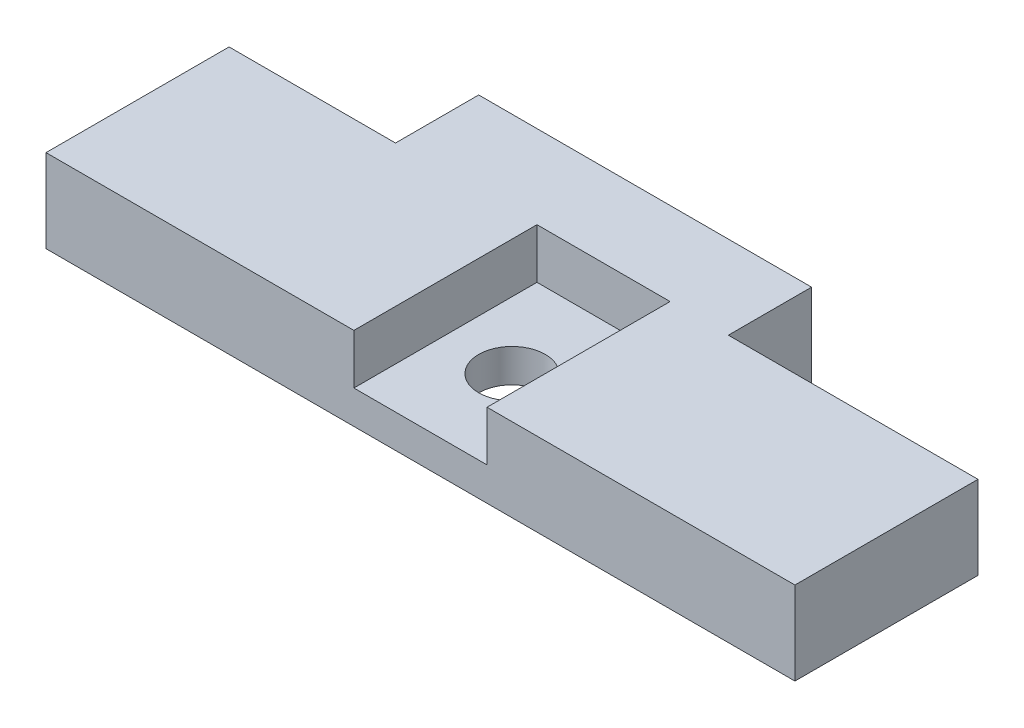
from build123d import *

# Parameters (mm, degrees)
BOSS_EXTRU_1_DEPTH      = 5
ESQUISSE2_W             = 8
ESQUISSE2_H             = 11
ENL_V_MAT_EXTRU_1_DEPTH = 3
ESQUISSE3_R             = 2
ENL_V_MAT_EXTRU_3_DEPTH = 25.067613093


with BuildPart() as part:
    # Esquisse1 → Boss.-Extru.1 (new body)
    with BuildSketch(Plane(origin=(0, 0, 0), x_dir=(1, 0, 0), z_dir=(0, 1, 0))):
        Polygon((7.5, 8), (7.5, 3), (22.5, 3), (22.5, -8), (-22.5, -8), (-22.5, 3), (-12.5, 3), (-12.5, 8), align=None)
    extrude(amount=BOSS_EXTRU_1_DEPTH)

    # Esquisse2 → Enlèv. mat.-Extru.1 (cut)
    with BuildSketch(Plane(origin=(0, 5, 0), x_dir=(1, 0, 0), z_dir=(0, 1, 0))):
        with Locations((0, -2.5)):
            Rectangle(ESQUISSE2_W, ESQUISSE2_H)
    extrude(amount=-ENL_V_MAT_EXTRU_1_DEPTH, mode=Mode.SUBTRACT)

    # Esquisse3 → Enlèv. mat.-Extru.3 (cut, through all)
    with BuildSketch(Plane(origin=(0, 2, 0), x_dir=(1, 0, 0), z_dir=(0, 1, 0))):
        with Locations(Location((0, -2.5, 0), (0, 0, 270))):
            Circle(ESQUISSE3_R)
    extrude(amount=-ENL_V_MAT_EXTRU_3_DEPTH, mode=Mode.SUBTRACT)


solid = part.part
